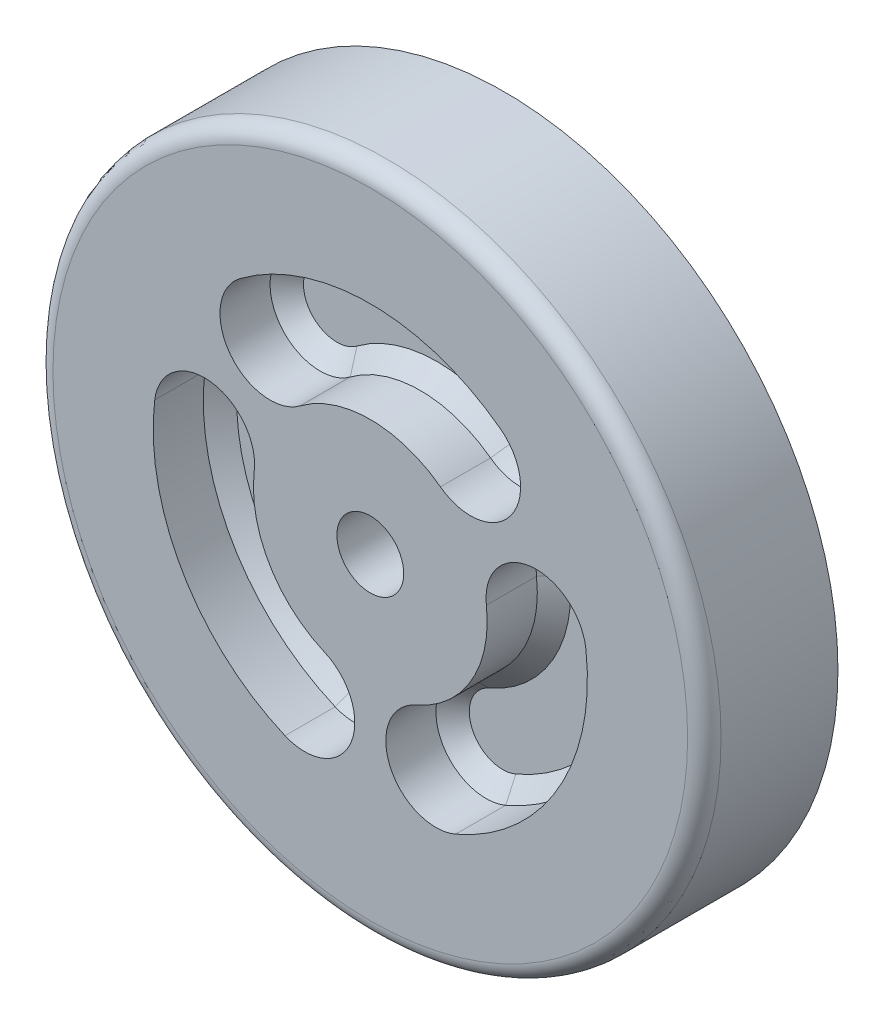
from build123d import *

# Parameters (mm, degrees)
SKETCH1_R           = 100
BOSS_EXTRUDE1_DEPTH = 40
CUT_EXTRUDE2_DEPTH  = 20
FILLET1_R           = 5
CHAMFER1_SIZE       = 5
SKETCH6_R           = 10
CUT_EXTRUDE3_DEPTH  = 147.969384635


with BuildPart() as part:
    # Sketch1 → Boss-Extrude1 (new body)
    with BuildSketch(Plane.XY):
        Circle(SKETCH1_R)
    extrude(amount=BOSS_EXTRUDE1_DEPTH)

    # Sketch5 → Cut-Extrude2 (cut)
    with BuildSketch(Plane.XY.offset(40)):
        with BuildLine():
            ThreePointArc((39, 52), (0, 65), (-39, 52))
            ThreePointArc((-39, 52), (-42, 31), (-21, 28))
            ThreePointArc((-21, 28), (0, 35), (21, 28))
            ThreePointArc((21, 28), (42, 31), (39, 52))
        make_face()
        with BuildLine():
            ThreePointArc((25.533320997, -59.774990748), (56.291651246, -32.5), (64.533320997, 7.774990748))
            ThreePointArc((64.533320997, 7.774990748), (47.846787517, 20.873066959), (34.748711306, 4.186533479))
            ThreePointArc((34.748711306, 4.186533479), (30.310889132, -17.5), (13.748711306, -32.186533479))
            ThreePointArc((13.748711306, -32.186533479), (5.846787517, -51.873066959), (25.533320997, -59.774990748))
        make_face()
        with BuildLine():
            ThreePointArc((-64.533320997, 7.774990748), (-56.291651246, -32.5), (-25.533320997, -59.774990748))
            ThreePointArc((-25.533320997, -59.774990748), (-5.846787517, -51.873066959), (-13.748711306, -32.186533479))
            ThreePointArc((-13.748711306, -32.186533479), (-30.310889132, -17.5), (-34.748711306, 4.186533479))
            ThreePointArc((-34.748711306, 4.186533479), (-47.846787517, 20.873066959), (-64.533320997, 7.774990748))
        make_face()
    extrude(amount=-CUT_EXTRUDE2_DEPTH, mode=Mode.SUBTRACT)

    # Fillet1
    fillet1_edges = [part.edges().sort_by_distance(p)[0] for p in [
        (-100, 0, 40),
    ]]
    fillet(fillet1_edges, radius=FILLET1_R)

    # Chamfer1
    chamfer1_edges = [part.edges().sort_by_distance(p)[0] for p in [
        (42, 31, 20),
        (0, 35, 20),
        (-42, 31, 20),
        (0, 65, 20),
        (5.846787517, -51.873066959, 20),
        (30.310889132, -17.5, 20),
        (47.846787517, 20.873066959, 20),
        (56.291651246, -32.5, 20),
        (-47.846787517, 20.873066959, 20),
        (-30.310889132, -17.5, 20),
        (-5.846787517, -51.873066959, 20),
        (-56.291651246, -32.5, 20),
    ]]
    chamfer(chamfer1_edges, length=CHAMFER1_SIZE)

    # Sketch6 → Cut-Extrude3 (cut, through all)
    with BuildSketch(Plane.XY.offset(40)):
        Circle(SKETCH6_R)
    extrude(amount=-CUT_EXTRUDE3_DEPTH, mode=Mode.SUBTRACT)


solid = part.part
